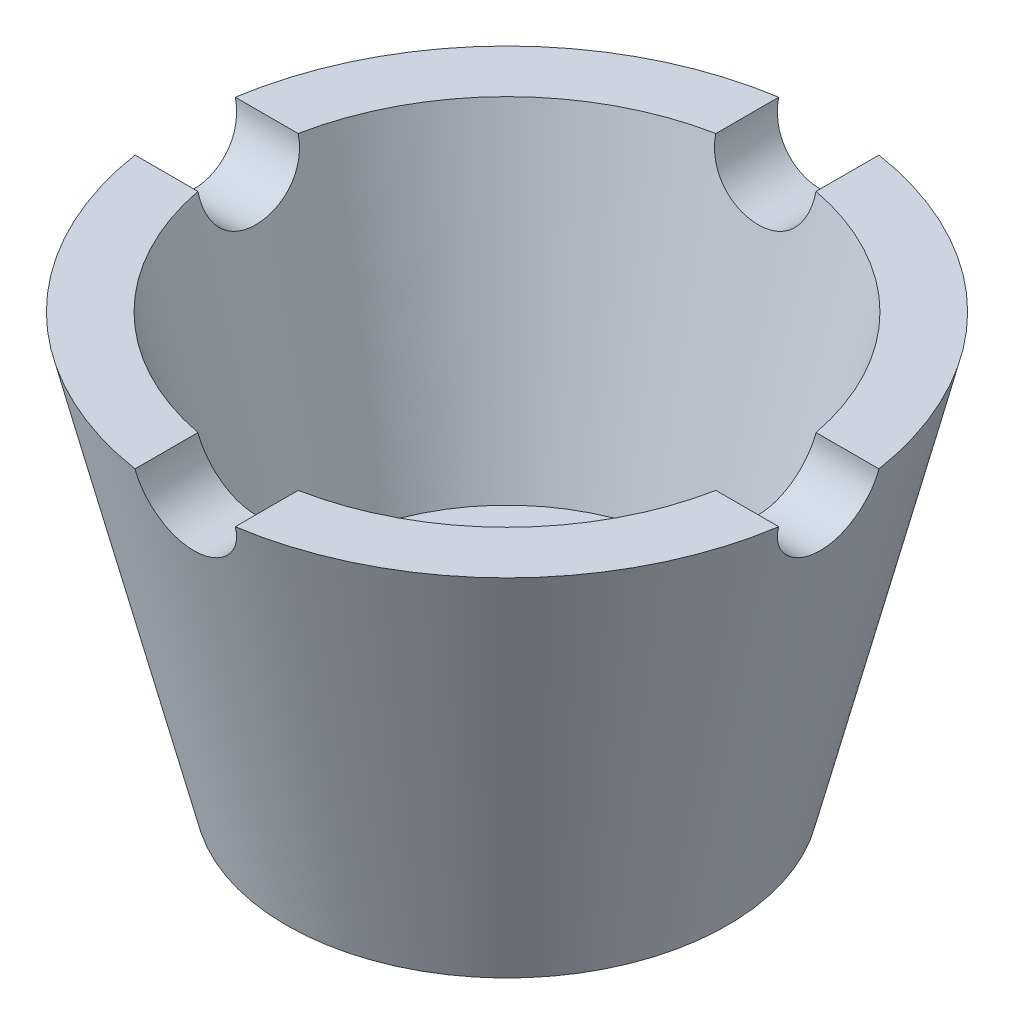
from build123d import *

# Parameters (mm, degrees)
CUT_EXTRUDE2_DEPTH      = 63.261545114
CUT_EXTRUDE2_DEPTH_BACK = 63.261545114
SKETCH5_R               = 5
CUT_EXTRUDE3_DEPTH      = 63.060454569
CUT_EXTRUDE3_DEPTH_BACK = 63.060454569
SKETCH6_R               = 5


with BuildPart() as part:
    # Sketch2 → Revolve1 (revolve)
    with BuildSketch(Plane.XY, mode=Mode.PRIVATE) as revolve1_sk:
        Polygon((22, -42), (32.5, 0), (26.315341562, 0), (18.815341562, -30), (11.25, -30), (11.25, -42), align=None)
    revolve(revolve1_sk.sketch.rotate(Axis((0, 41.438546828, 0), (0, -1, 0)), 90), axis=Axis((0, 41.438546828, 0), (0, -1, 0)))

    # Sketch5 → Cut-Extrude2 (cut, two sides: drawn at the far end of the back side and taken through both)
    with BuildSketch(Plane.XY.offset(-CUT_EXTRUDE2_DEPTH_BACK)):
        Circle(SKETCH5_R)
    extrude(amount=CUT_EXTRUDE2_DEPTH + CUT_EXTRUDE2_DEPTH_BACK, mode=Mode.SUBTRACT)

    # Sketch6 → Cut-Extrude3 (cut, two sides: drawn at the far end of the back side and taken through both)
    with BuildSketch(Plane(origin=(0, 0, 0), x_dir=(0, 0, -1), z_dir=(1, 0, 0)).offset(-CUT_EXTRUDE3_DEPTH_BACK)):
        Circle(SKETCH6_R)
    extrude(amount=CUT_EXTRUDE3_DEPTH + CUT_EXTRUDE3_DEPTH_BACK, mode=Mode.SUBTRACT)


solid = part.part
